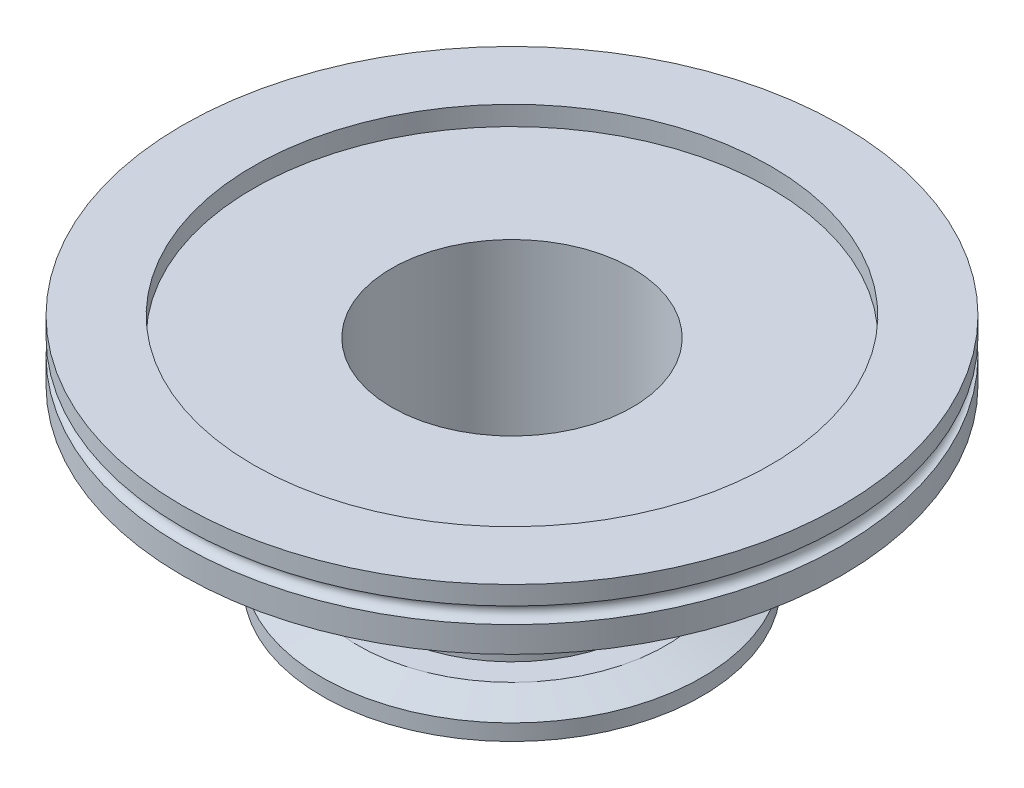
from build123d import *

# Parameters (mm, degrees)
SKETCH1_W  = 64.999999997
SKETCH1_H  = 11.938
SKETCH13_W = 5.08
SKETCH13_H = 2.032


with BuildPart() as part:
    # Sketch1 → Blank (revolve)
    with BuildSketch(Plane.XY):
        with Locations((-32.499999999, 0)):
            Rectangle(SKETCH1_W, SKETCH1_H)
    revolve(axis=Axis((0, 5.969, 0), (0, -1, 0)))

    # Sketch7 → Single Side Bore (revolve, cut)
    with BuildSketch(Plane.XY, mode=Mode.PRIVATE) as single_side_bore_sk:
        Polygon((-23.749, -5.969), (-23.749, 2.159), (-51.029999997, 2.159), (-51.029999997, 5.969), (0, 5.969), (0, -5.969), align=None)
    revolve(single_side_bore_sk.sketch.rotate(Axis((0, 5.969, 0), (0, 1, 0)), 270), axis=Axis((0, 5.969, 0), (0, 1, 0)), mode=Mode.SUBTRACT)



with BuildPart() as body_2:
    # Sketch9 → KF Flange (revolve)
    with BuildSketch(Plane.XY, mode=Mode.PRIVATE) as kf_flange_sk:
        Polygon((30.355443212, -35.251), (23.749, -35.251), (23.749, -37.7148), (26.1239, -37.7148), (26.1239, -40.331), (37.465, -40.331), (37.465, -37.156), align=None)
    revolve(kf_flange_sk.sketch.rotate(Axis((0, 5.969, 0), (0, -1, 0)), 180), axis=Axis((0, 5.969, 0), (0, -1, 0)))


with BuildPart() as part_1:
    add(part.part)

    add(body_2.part)  # Revolve1 merges body 2
    # Sketch8 → Revolve1 (revolve)
    with BuildSketch(Plane.XY, mode=Mode.PRIVATE) as revolve1_sk:
        Polygon((-23.749, 2.159), (-23.749, -13.081), (-23.749, -22.4748), (-23.749, -37.7148), (-25.4, -37.7148), (-25.4, -22.4748), (-25.4, -13.081), (-25.4, 2.159), align=None)
    revolve(revolve1_sk.sketch.rotate(Axis((0, 0, 0), (0, -1, 0)), 180), axis=Axis((0, 0, 0), (0, -1, 0)))

    # Sketch13 → Cut-Revolve2 (revolve, cut)
    with BuildSketch(Plane.XY, mode=Mode.PRIVATE) as cut_revolve2_sk:
        with Locations((-59.919999997, -4.953)):
            Rectangle(SKETCH13_W, SKETCH13_H)
    revolve(cut_revolve2_sk.sketch.rotate(Axis((0, 0, 0), (0, -1, 0)), 270), axis=Axis((0, 0, 0), (0, -1, 0)), mode=Mode.SUBTRACT)

    # Sketch15 → Cut-Revolve3 (revolve, cut)
    with BuildSketch(Plane.XY):
        with BuildLine():
            Line((-64.999999997, 2.286), (-64.999999997, -0.889))
            ThreePointArc((-64.999999997, -0.889), (-63.412499997, 0.6985), (-64.999999997, 2.286))
        make_face()
    revolve(axis=Axis((0, 0, 0), (0, -1, 0)), mode=Mode.SUBTRACT)


solid = part_1.part
